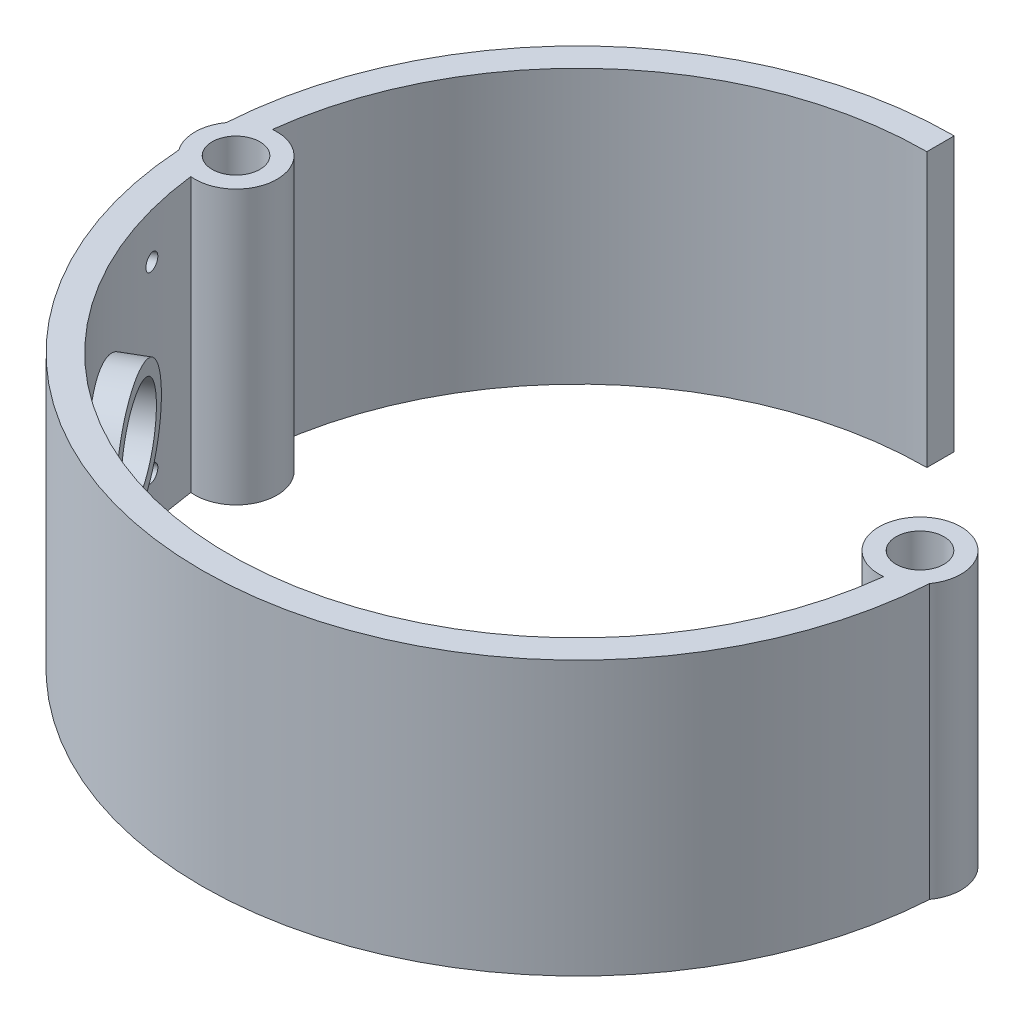
from build123d import *

# Parameters (mm, degrees)
SKETCH1_R           = 4.445
BOSS_EXTRUDE2_DEPTH = 50.8
SKETCH2_R           = 8.255
CUT_EXTRUDE1_DEPTH  = 141.089519336
SKETCH3_R           = 1.5
CUT_EXTRUDE2_DEPTH  = 141.089519442
SKETCH4_R           = 11.43
SKETCH4_R_2         = 8.89
BOSS_EXTRUDE3_DEPTH = 6.35


with BuildPart() as part:
    # Sketch1 → Boss-Extrude2 (new body)
    with BuildSketch(Plane(origin=(0, 0, 0), x_dir=(1, 0, 0), z_dir=(0, 1, 0))):
        with BuildLine():
            ThreePointArc((-0.8255, 7.575153447), (20.462166579, 48.403489486), (63.5, 64.77))
            Line((63.5, 64.77), (63.5, 69.85))
            ThreePointArc((63.5, 69.85), (15.695186698, 50.928600267), (-6.2103, 4.415492488))
            ThreePointArc((-6.2103, 4.415492488), (-7.62, 0), (-6.2103, -4.415492488))
            ThreePointArc((-6.2103, -4.415492488), (63.5, -69.85), (133.2103, -4.415492488))
            ThreePointArc((133.2103, -4.415492488), (123.143643591, 6.572131712), (127.8255, -7.575153447))
            ThreePointArc((127.8255, -7.575153447), (63.5, -64.77), (-0.8255, -7.575153447))
            ThreePointArc((-0.8255, -7.575153447), (7.62, 0), (-0.8255, 7.575153447))
        make_face()
        Circle(SKETCH1_R, mode=Mode.SUBTRACT)
        with Locations((127, 0)):
            Circle(SKETCH1_R, mode=Mode.SUBTRACT)
    extrude(amount=BOSS_EXTRUDE2_DEPTH)

    # Sketch2 → Cut-Extrude1 (cut, through all)
    with BuildSketch(Plane(origin=(47.625, 0, -27.49630657), x_dir=(0, -1, 0), z_dir=(-0.8660254037844398, 0, 0.499999999999998))):
        with Locations((-25.4, 31.75)):
            Circle(SKETCH2_R)
    extrude(amount=CUT_EXTRUDE1_DEPTH, mode=Mode.SUBTRACT)

    # Sketch3 → Cut-Extrude2 (cut, through all)
    with BuildSketch(Plane(origin=(47.625, 0, -27.49630657), x_dir=(0, -1, 0), z_dir=(-0.8660254037844398, 0, 0.499999999999998))):
        with Locations((-42.4, 14.75)):
            Circle(SKETCH3_R)
        with Locations((-8.4, 14.75)):
            Circle(SKETCH3_R)
        with Locations((-8.4, 48.75)):
            Circle(SKETCH3_R)
        with Locations((-42.4, 48.75)):
            Circle(SKETCH3_R)
    extrude(amount=CUT_EXTRUDE2_DEPTH, mode=Mode.SUBTRACT)

    # Sketch4 → Boss-Extrude3 (add)
    with BuildSketch(Plane(origin=(-9.567317666, 0, 5.52369343), x_dir=(0, -1, 0), z_dir=(-0.8660254037844398, 0, 0.499999999999998))):
        with Locations((-25.4, 31.75)):
            Circle(SKETCH4_R)
        with Locations((-25.4, 31.75)):
            Circle(SKETCH4_R_2, mode=Mode.SUBTRACT)
    extrude(amount=-BOSS_EXTRUDE3_DEPTH)


solid = part.part
